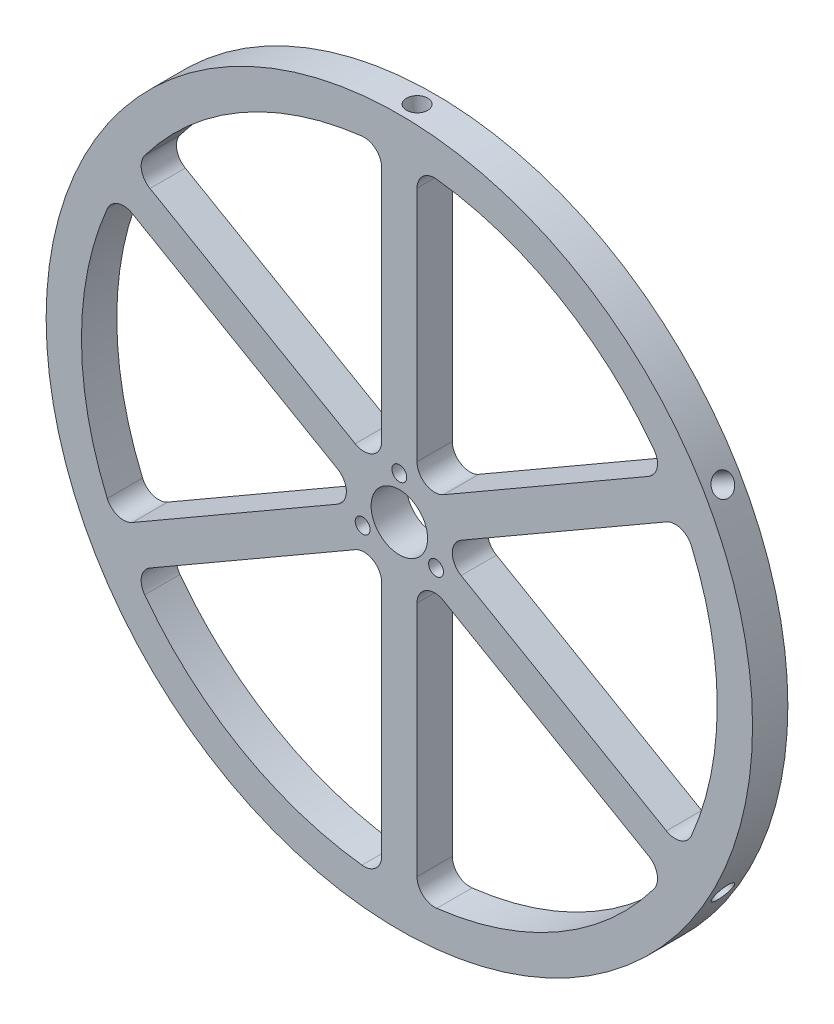
from build123d import *

# Parameters (mm, degrees)
ESQUISSE1_R                  = 100
BOSS_EXTRU_1_DEPTH           = 10
ENL_V_MAT_EXTRU_1_DEPTH      = 142.774468788
ENL_V_MAT_EXTRU_1_DEPTH_BACK = 142.774468788
CONG_1_R                     = 5
ENL_V_MAT_EXTRU_2_DEPTH      = 142.774468788
ENL_V_MAT_EXTRU_2_DEPTH_BACK = 142.774468788
ESQUISSE3_R                  = 8
ENL_V_MAT_EXTRU_3_DEPTH      = 142.774468788
ENL_V_MAT_EXTRU_3_DEPTH_BACK = 142.774468788
ESQUISSE4_R                  = 2.1
ENL_V_START                  = 100
ESQUISSE5_R                  = 3
ENL_V_MAT_EXTRU_4_DEPTH      = 10
R_P_TITION_CIRCULAIRE1_COUNT = 6


with BuildPart() as part:
    # Esquisse1 → Boss.-Extru.1 (new body)
    with BuildSketch(Plane.XY):
        Circle(ESQUISSE1_R)
    extrude(amount=BOSS_EXTRU_1_DEPTH)

    # Esquisse2 → Enlèv. mat.-Extru.1 (cut, two sides: drawn at the far end of the back side and taken through both)
    with BuildSketch(Plane.XY.offset(10).offset(-ENL_V_MAT_EXTRU_1_DEPTH_BACK)):
        with BuildLine():
            Line((10, 0), (80.321912081, 40.60037487))
            ThreePointArc((80.321912081, 40.60037487), (90, 0), (80.321912081, -40.60037487))
            Line((80.321912081, -40.60037487), (10, 0))
        make_face()
        with BuildLine():
            Line((5, -8.660254038), (75.321912081, -49.260628908))
            ThreePointArc((75.321912081, -49.260628908), (45, -77.942286341), (5, -89.861003778))
            Line((5, -89.861003778), (5, -8.660254038))
        make_face()
        with BuildLine():
            Line((-5, -8.660254038), (-5, -89.861003778))
            ThreePointArc((-5, -89.861003778), (-45, -77.942286341), (-75.321912081, -49.260628908))
            Line((-75.321912081, -49.260628908), (-5, -8.660254038))
        make_face()
        with BuildLine():
            Line((-10, 0), (-80.321912081, -40.60037487))
            ThreePointArc((-80.321912081, -40.60037487), (-90, 0), (-80.321912081, 40.60037487))
            Line((-80.321912081, 40.60037487), (-10, 0))
        make_face()
        with BuildLine():
            Line((-5, 8.660254038), (-75.321912081, 49.260628908))
            ThreePointArc((-75.321912081, 49.260628908), (-45, 77.942286341), (-5, 89.861003778))
            Line((-5, 89.861003778), (-5, 8.660254038))
        make_face()
        with BuildLine():
            Line((5, 8.660254038), (5, 89.861003778))
            ThreePointArc((5, 89.861003778), (45, 77.942286341), (75.321912081, 49.260628908))
            Line((75.321912081, 49.260628908), (5, 8.660254038))
        make_face()
    extrude(amount=ENL_V_MAT_EXTRU_1_DEPTH + ENL_V_MAT_EXTRU_1_DEPTH_BACK, mode=Mode.SUBTRACT)

    # Congé1
    cong_1_edges = [part.edges().sort_by_distance(p)[0] for p in [
        (80.321912081, -40.60037487, 5),
        (10, 0, 5),
        (80.321912081, 40.60037487, 5),
        (-80.321912081, 40.60037487, 5),
        (-10, 0, 5),
        (-80.321912081, -40.60037487, 5),
        (-5, 89.861003778, 5),
        (-5, 8.660254038, 5),
        (-75.321912081, 49.260628908, 5),
        (75.321912081, 49.260628908, 5),
        (5, 8.660254038, 5),
        (5, 89.861003778, 5),
        (-75.321912081, -49.260628908, 5),
        (-5, -8.660254038, 5),
        (-5, -89.861003778, 5),
        (5, -89.861003778, 5),
        (5, -8.660254038, 5),
        (75.321912081, -49.260628908, 5),
    ]]
    fillet(cong_1_edges, radius=CONG_1_R)

    # Esquisse3 → Enlèv. mat.-Extru.2 (cut, two sides: drawn at the far end of the back side and taken through both)
    with BuildSketch(Plane.XY.offset(10).offset(-ENL_V_MAT_EXTRU_2_DEPTH_BACK)):
        Circle(ESQUISSE3_R)
    extrude(amount=ENL_V_MAT_EXTRU_2_DEPTH + ENL_V_MAT_EXTRU_2_DEPTH_BACK, mode=Mode.SUBTRACT)

    # Esquisse4 → Enlèv. mat.-Extru.3 (cut, two sides: drawn at the far end of the back side and taken through both)
    with BuildSketch(Plane.XY.offset(10).offset(-ENL_V_MAT_EXTRU_3_DEPTH_BACK)):
        with Locations((0, 12)):
            Circle(ESQUISSE4_R)
        with Locations((10.392304845, -6)):
            Circle(ESQUISSE4_R)
        with Locations((-10.392304845, -6)):
            Circle(ESQUISSE4_R)
    extrude(amount=ENL_V_MAT_EXTRU_3_DEPTH + ENL_V_MAT_EXTRU_3_DEPTH_BACK, mode=Mode.SUBTRACT)

    # Esquisse5 → Enlèv. mat.-Extru.4 (cut)
    with BuildSketch(Plane(origin=(0, 0, 0), x_dir=(0, 0, -1), z_dir=(0, 1, 0)).offset(ENL_V_START)):
        with Locations(Location((-5, 0, 0), (0, 0, 180))):
            Circle(ESQUISSE5_R)
    enl_v_mat_extru_4 = extrude(amount=-ENL_V_MAT_EXTRU_4_DEPTH, mode=Mode.SUBTRACT)

    # Répétition circulaire1: Enlèv. mat.-Extru.4 ×6 about axis
    r_p_tition_circulaire1_axis = Axis((0, 0, 0), (0, 0, 1))
    for i in range(1, R_P_TITION_CIRCULAIRE1_COUNT):
        add(enl_v_mat_extru_4.rotate(r_p_tition_circulaire1_axis, i * 360 / R_P_TITION_CIRCULAIRE1_COUNT), mode=Mode.SUBTRACT)


solid = part.part
